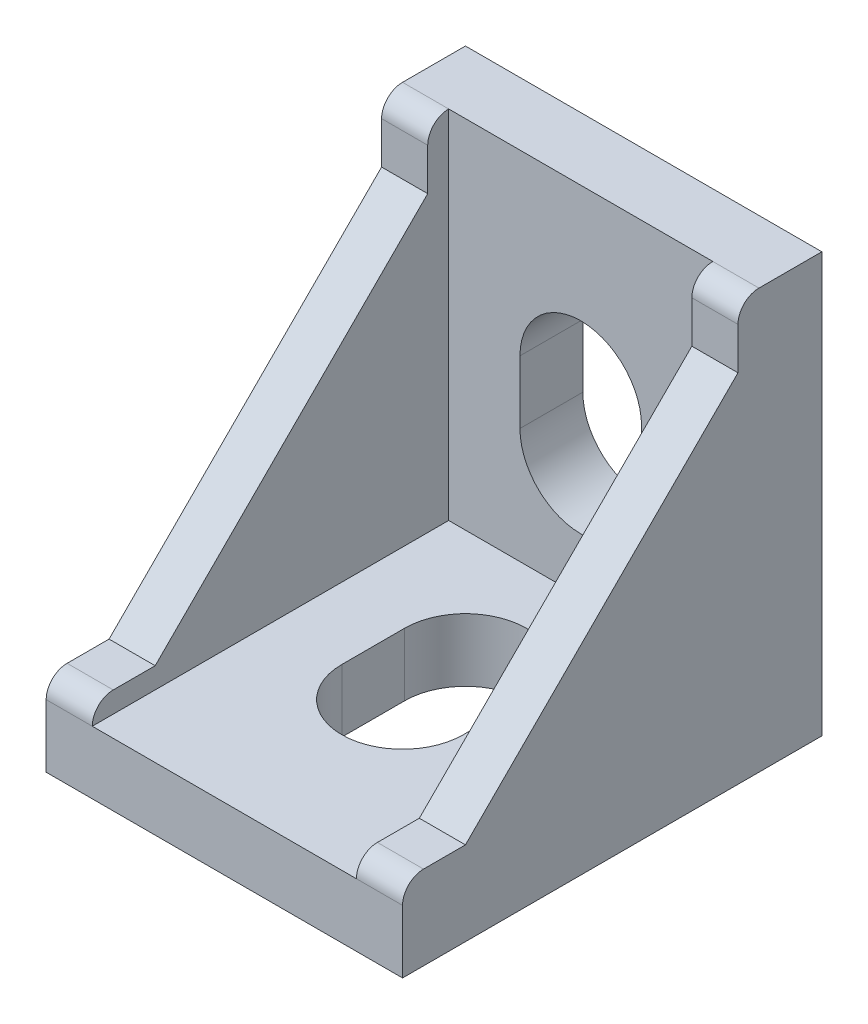
from build123d import *

# Parameters (mm, degrees)
SKETCH_1_W          = 17
SKETCH_1_H          = 20
EXTRUDE_1_DEPTH     = 20
SKETCH_2_W          = 12.6
SKETCH_2_H          = 17
CUT_EXTRUDE_1_DEPTH = 17
CUT_EXTRUDE_2_DEPTH = 17
CUT_EXTRUDE_3_DEPTH = 3
CUT_EXTRUDE_4_DEPTH = 3


with BuildPart() as part:
    # 草图1 → 凸台-拉伸1 (new body)
    with BuildSketch(Plane(origin=(0, 0, 0), x_dir=(1, 0, 0), z_dir=(0, 1, 0))):
        Rectangle(SKETCH_1_W, SKETCH_1_H)
    extrude(amount=EXTRUDE_1_DEPTH)

    # 草图2 → 切除-拉伸1 (cut)
    with BuildSketch(Plane(origin=(0, 20, 0), x_dir=(1, 0, 0), z_dir=(0, 1, 0))):
        with Locations((0, -1.5)):
            Rectangle(SKETCH_2_W, SKETCH_2_H)
    extrude(amount=-CUT_EXTRUDE_1_DEPTH, mode=Mode.SUBTRACT)

    # 草图3 → 切除-拉伸2 (cut)
    with BuildSketch(Plane(origin=(8.5, 0, 0), x_dir=(0, 0, -1), z_dir=(1, 0, 0))):
        with BuildLine():
            Line((6, 19), (6, 17))
            Line((6, 17), (-7, 4))
            Line((-7, 4), (-9, 4))
            ThreePointArc((-9, 4), (-9.707106781, 3.707106781), (-10, 3))
            Line((-10, 3), (-10, 20))
            Line((-10, 20), (7, 20))
            ThreePointArc((7, 20), (6.292893219, 19.707106781), (6, 19))
        make_face()
    extrude(amount=-CUT_EXTRUDE_2_DEPTH, mode=Mode.SUBTRACT)

    # 草图4 → 切除-拉伸3 (cut)
    with BuildSketch(Plane.XY.offset(-7)):
        with BuildLine():
            Line((2.9, 11.5), (2.9, 8.5))
            ThreePointArc((2.9, 8.5), (0, 5.6), (-2.9, 8.5))
            Line((-2.9, 8.5), (-2.9, 11.5))
            ThreePointArc((-2.9, 11.5), (0, 14.4), (2.9, 11.5))
        make_face()
    extrude(amount=-CUT_EXTRUDE_3_DEPTH, mode=Mode.SUBTRACT)

    # 草图5 → 切除-拉伸4 (cut)
    with BuildSketch(Plane(origin=(0, 3, 0), x_dir=(1, 0, 0), z_dir=(0, 1, 0))):
        with BuildLine():
            Line((2.9, 1.5), (2.9, -1.5))
            ThreePointArc((2.9, -1.5), (0, -4.4), (-2.9, -1.5))
            Line((-2.9, -1.5), (-2.9, 1.5))
            ThreePointArc((-2.9, 1.5), (0, 4.4), (2.9, 1.5))
        make_face()
    extrude(amount=-CUT_EXTRUDE_4_DEPTH, mode=Mode.SUBTRACT)


solid = part.part
